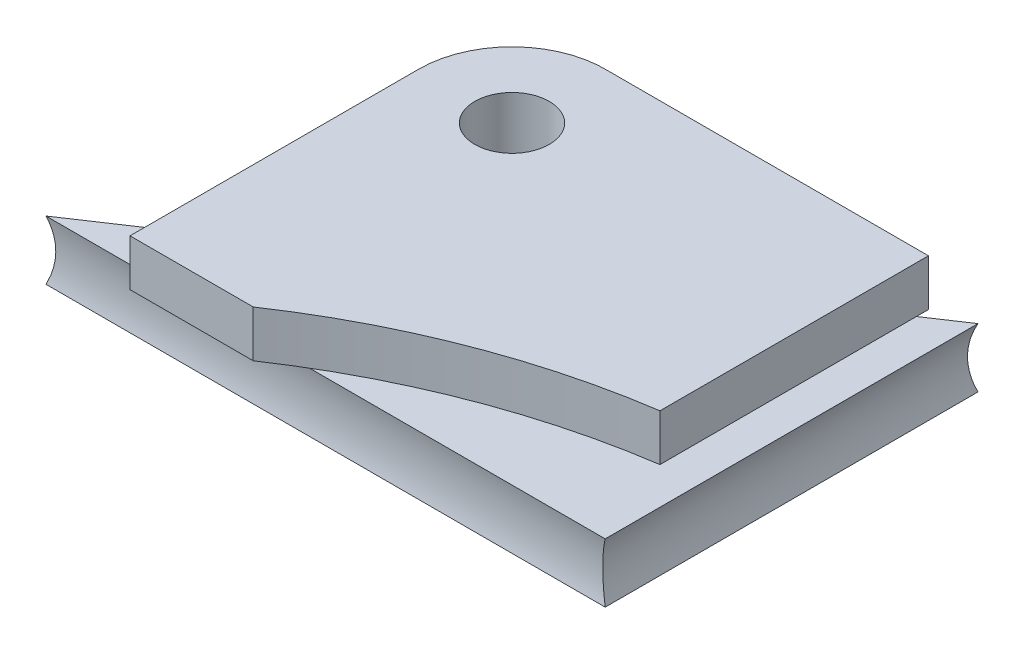
from build123d import *

# Parameters (mm, degrees)
BOSS_EXTRUDE1_DEPTH     = 6.35
SKETCH1_3_R             = 10
SKETCH1_3_R_2           = 4
BOSS_EXTRUDE2_DEPTH     = 20
CUT_EXTRUDE1_DEPTH      = 42.231056256
CUT_EXTRUDE1_DEPTH_BACK = 42.231056256
SKETCH3_R               = 7.768492306
CUT_EXTRUDE3_DEPTH      = 42.231056256
CUT_EXTRUDE3_DEPTH_BACK = 42.231056256
SKETCH4_R               = 12.223418735
BOSS_EXTRUDE3_START     = -5
BOSS_EXTRUDE3_DEPTH     = 5


with BuildPart() as part:
    # Sketch1 → Boss-Extrude1 (new body)
    with BuildSketch(Plane(origin=(0, 0, 0), x_dir=(1, 0, 0), z_dir=(0, 1, 0))):
        with BuildLine():
            Line((30, -20), (30, 20))
            Line((30, 20), (8.320502943, 5.547001962))
            ThreePointArc((8.320502943, 5.547001962), (9.570920265, 2.897841487), (10, 0))
            ThreePointArc((10, 0), (2.897841487, -9.570920265), (-8.320502943, -5.547001962))
            Line((-8.320502943, -5.547001962), (-30, -20))
            Line((-30, -20), (30, -20))
        make_face()
    extrude(amount=BOSS_EXTRUDE1_DEPTH)

    # Sketch1<3> → Boss-Extrude2 (add)
    # profile 1 of 3: a face of its own
    with BuildSketch(Plane(origin=(0, 0, 0), x_dir=(1, 0, 0), z_dir=(0, 1, 0))):
        with Locations(Location((0, 0, 0), (0, 0, 33.690067526))):
            Circle(SKETCH1_3_R)
        with Locations(Location((0, 0, 0), (0, 0, 270))):
            Circle(SKETCH1_3_R_2, mode=Mode.SUBTRACT)
    # profile 2 of 3: a face of its own
    with BuildSketch(Plane(origin=(0, 0, 0), x_dir=(1, 0, 0), z_dir=(0, 1, 0))):
        with BuildLine():
            ThreePointArc((10, 0), (9.570920265, 2.897841487), (8.320502943, 5.547001962))
            Line((8.320502943, 5.547001962), (3.328201177, 2.218800785))
            ThreePointArc((3.328201177, 2.218800785), (3.828368106, 1.159136595), (4, 0))
            ThreePointArc((4, 0), (1.159136595, -3.828368106), (-3.328201177, -2.218800785))
            Line((-3.328201177, -2.218800785), (-8.320502943, -5.547001962))
            ThreePointArc((-8.320502943, -5.547001962), (2.897841487, -9.570920265), (10, 0))
        make_face()
    # profile 3 of 3: a face of its own
    with BuildSketch(Plane(origin=(0, 0, 0), x_dir=(1, 0, 0), z_dir=(0, 1, 0))):
        with BuildLine():
            Line((3.328201177, 2.218800785), (8.320502943, 5.547001962))
            ThreePointArc((8.320502943, 5.547001962), (-5.547001962, 8.320502943), (-8.320502943, -5.547001962))
            Line((-8.320502943, -5.547001962), (-3.328201177, -2.218800785))
            ThreePointArc((-3.328201177, -2.218800785), (-2.218800785, 3.328201177), (3.328201177, 2.218800785))
        make_face()
    extrude(amount=BOSS_EXTRUDE2_DEPTH)

    # Sketch3 → Cut-Extrude1 (cut, two sides: drawn at the far end of the back side and taken through both)
    with BuildSketch(Plane.XY.offset(-CUT_EXTRUDE1_DEPTH_BACK)):
        with Locations((37.090052729, 3.175)):
            Circle(SKETCH3_R)
    extrude(amount=CUT_EXTRUDE1_DEPTH + CUT_EXTRUDE1_DEPTH_BACK, mode=Mode.SUBTRACT)

    # Sketch4 → Cut-Extrude3 (cut, two sides: drawn at the far end of the back side and taken through both)
    with BuildSketch(Plane(origin=(0, 0, 0), x_dir=(0, 0, -1), z_dir=(1, 0, 0)).offset(-CUT_EXTRUDE3_DEPTH_BACK)):
        with Locations((-31.803869729, 3.175)):
            Circle(SKETCH4_R)
    extrude(amount=CUT_EXTRUDE3_DEPTH + CUT_EXTRUDE3_DEPTH_BACK, mode=Mode.SUBTRACT)

    # Sketch5 → Boss-Extrude3 (add)
    with BuildSketch(Plane(origin=(0, 20, 0), x_dir=(1, 0, 0), z_dir=(0, 1, 0)).offset(BOSS_EXTRUDE3_START)):
        with BuildLine():
            Line((34.688363183, 9.995142945), (0.311636817, 9.995142945))
            ThreePointArc((0.311636817, 9.995142945), (7.18040278, 6.960015511), (10, 0))
            ThreePointArc((10, 0), (0, -10), (-10, 0))
            Line((-10, 0), (-10, -30.985714007))
            Line((-10, -30.985714007), (3.222370876, -30.985714007))
            ThreePointArc((3.222370876, -30.985714007), (18.272166371, -23.133524369), (34.688363183, -18.813604371))
            Line((34.688363183, -18.813604371), (34.688363183, 9.995142945))
        make_face()
    extrude(amount=BOSS_EXTRUDE3_DEPTH)


solid = part.part
